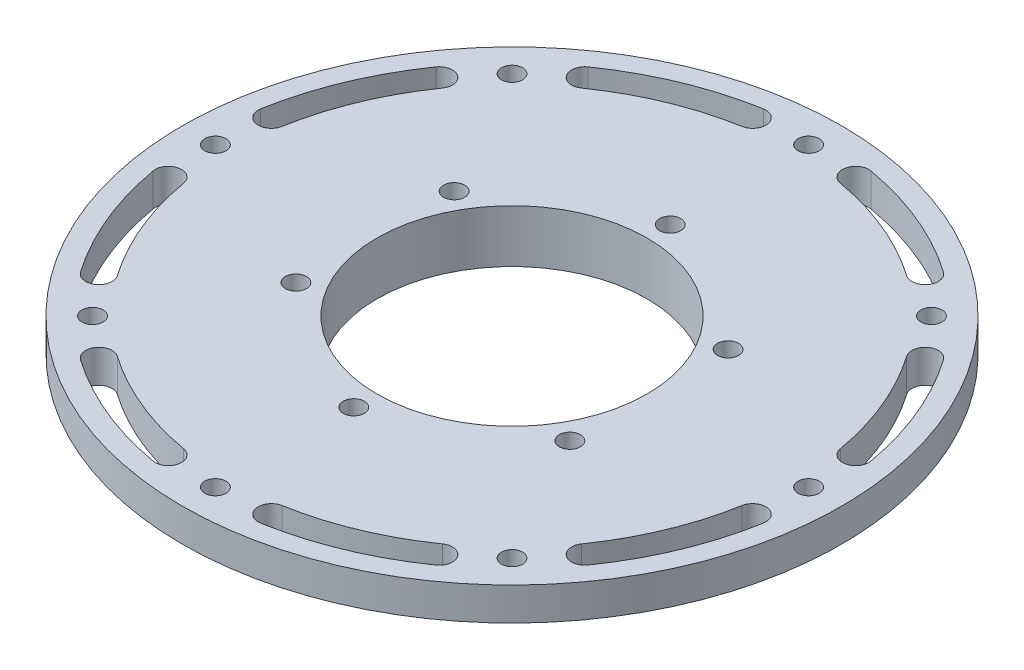
from build123d import *

# Parameters (mm, degrees)
SKETCH_1_R               = 20.5
EXTRUDE_1_DEPTH          = 7
SKETCH_2_R               = 50
EXTRUDE_2_DEPTH          = 8
CUT_EXTRUDE_1_REACH      = 74.284
SKETCH_3_R               = 16.5
CUT_EXTRUDE_2_REACH      = 73.162
SKETCH_4_R               = 1.6
PATTERN_CIRCULAR_1_COUNT = 6
SKETCH_6_R               = 50
SKETCH_6_R_2             = 27.5
CUT_EXTRUDE_3_DEPTH      = 3
CUT_EXTRUDE_4_REACH      = 74.284
SKETCH_7_R               = 1.6
PATTERN_CIRCULAR_2_COUNT = 8
CUT_EXTRUDE_5_REACH      = 73.414
PATTERN_CIRCULAR_3_COUNT = 8
SKETCH_11_R              = 20.5
EXTRUDE_3_DEPTH          = 4
SKETCH_12_R              = 2.025
CUT_EXTRUDE_6_DEPTH      = 72.561162651
SKETCH_13_R              = 5
CUT_EXTRUDE_7_DEPTH      = 73.284161474
SKETCH_14_R              = 20.5
CUT_EXTRUDE_8_DEPTH      = 73.284161474


with BuildPart() as part:
    # 草图1 → 凸台-拉伸1 (new body)
    with BuildSketch(Plane(origin=(0, 0, 0), x_dir=(1, 0, 0), z_dir=(0, 1, 0))):
        with Locations(Location((0, 0, 0), (0, 0, 270))):
            Circle(SKETCH_1_R)
    extrude(amount=EXTRUDE_1_DEPTH)

    # 草图2 → 凸台-拉伸2 (add)
    with BuildSketch(Plane(origin=(0, 7, 0), x_dir=(1, 0, 0), z_dir=(0, 1, 0))):
        with Locations(Location((0, 0, 0), (0, 0, 270))):
            Circle(SKETCH_2_R)
    extrude(amount=EXTRUDE_2_DEPTH)

    # 草图3 → 切除-拉伸1 (cut, up to next)
    with BuildSketch(Plane.XZ, mode=Mode.PRIVATE) as cut_extrude_1_sk1:
        with Locations(Location((0, 0, 0), (0, 0, 270))):
            Circle(SKETCH_3_R)
    cut_extrude_1_tool1 = extrude(cut_extrude_1_sk1.sketch, amount=-CUT_EXTRUDE_1_REACH, mode=Mode.PRIVATE) & part.part
    add(cut_extrude_1_tool1.solids().sort_by_distance((0, 0, 0))[0], mode=Mode.SUBTRACT)

    # 草图4 → 切除-拉伸2 (cut, up to next)
    with BuildSketch(Plane.XZ.offset(-7), mode=Mode.PRIVATE) as cut_extrude_2_sk1:
        with Locations(Location((0, 24, 0), (0, 0, 270))):
            Circle(SKETCH_4_R)
    cut_extrude_2_tool1 = extrude(cut_extrude_2_sk1.sketch, amount=-CUT_EXTRUDE_2_REACH, mode=Mode.PRIVATE) & part.part
    cut_extrude_2 = cut_extrude_2_tool1.solids().sort_by_distance((0, 7, 24))[0]
    add(cut_extrude_2, mode=Mode.SUBTRACT)

    # 阵列(圆周)1: 切除-拉伸2 ×6 about axis
    pattern_circular_1_axis = Axis((0, 0, 0), (0, 1, 0))
    for i in range(1, PATTERN_CIRCULAR_1_COUNT):
        add(cut_extrude_2.rotate(pattern_circular_1_axis, i * 360 / PATTERN_CIRCULAR_1_COUNT), mode=Mode.SUBTRACT)

    # 草图6 → 切除-拉伸3 (cut)
    with BuildSketch(Plane.XZ.offset(-7)):
        with Locations(Location((0, 0, 0), (0, 0, 270))):
            Circle(SKETCH_6_R)
        with Locations(Location((0, 0, 0), (0, 0, 270))):
            Circle(SKETCH_6_R_2, mode=Mode.SUBTRACT)
    extrude(amount=-CUT_EXTRUDE_3_DEPTH, mode=Mode.SUBTRACT)

    # 草图7 → 切除-拉伸4 (cut, up to next)
    with BuildSketch(Plane(origin=(0, 15, 0), x_dir=(1, 0, 0), z_dir=(0, 1, 0)), mode=Mode.PRIVATE) as cut_extrude_4_sk1:
        with Locations(Location((0, 45, 0), (0, 0, 270))):
            Circle(SKETCH_7_R)
    cut_extrude_4_tool1 = extrude(cut_extrude_4_sk1.sketch, amount=-CUT_EXTRUDE_4_REACH, mode=Mode.PRIVATE) & part.part
    cut_extrude_4 = cut_extrude_4_tool1.solids().sort_by_distance((0, 15, -45))[0]
    add(cut_extrude_4, mode=Mode.SUBTRACT)

    # 阵列(圆周)2: 切除-拉伸4 ×8 about axis
    pattern_circular_2_axis = Axis((0, 0, 0), (0, 1, 0))
    for i in range(1, PATTERN_CIRCULAR_2_COUNT):
        add(cut_extrude_4.rotate(pattern_circular_2_axis, i * 360 / PATTERN_CIRCULAR_2_COUNT), mode=Mode.SUBTRACT)

    # 草图9 → 切除-拉伸5 (cut, up to next)
    with BuildSketch(Plane.XZ.offset(-10), mode=Mode.PRIVATE) as cut_extrude_5_sk1:
        with BuildLine():
            ThreePointArc((-7.46687164, 42.34673338), (-16.455387592, 39.726819898), (-24.663786763, 35.223537904))
            ThreePointArc((-24.663786763, 35.223537904), (-27.449243724, 35.71468912), (-26.958092508, 38.500146082))
            ThreePointArc((-26.958092508, 38.500146082), (-17.986121321, 43.422338028), (-8.16146435, 46.285964392))
            ThreePointArc((-8.16146435, 46.285964392), (-5.844552489, 44.663645241), (-7.46687164, 42.34673338))
        make_face()
    cut_extrude_5_tool1 = extrude(cut_extrude_5_sk1.sketch, amount=-CUT_EXTRUDE_5_REACH, mode=Mode.PRIVATE) & part.part
    cut_extrude_5 = cut_extrude_5_tool1.solids().sort_by_distance((-17.046965, 10, 41.155015))[0]
    add(cut_extrude_5, mode=Mode.SUBTRACT)

    # 阵列(圆周)3: 切除-拉伸5 ×8 about axis
    pattern_circular_3_axis = Axis((0, 0, 0), (0, 1, 0))
    for i in range(1, PATTERN_CIRCULAR_3_COUNT):
        add(cut_extrude_5.rotate(pattern_circular_3_axis, i * 360 / PATTERN_CIRCULAR_3_COUNT), mode=Mode.SUBTRACT)

    # 草图11 → 凸台-拉伸3 (add)
    with BuildSketch(Plane.XZ):
        with Locations(Location((0, 0, 0), (0, 0, 90))):
            Circle(SKETCH_11_R)
    extrude(amount=-EXTRUDE_3_DEPTH)

    # 草图12 → 切除-拉伸6 (cut, through all)
    with BuildSketch(Plane(origin=(0, 4, 0), x_dir=(1, 0, 0), z_dir=(0, 1, 0))):
        with Locations(Location((0, 11.5, 0), (0, 0, 270))):
            Circle(SKETCH_12_R)
        with Locations(Location((11.5, 0, 0), (0, 0, 270))):
            Circle(SKETCH_12_R)
        with Locations(Location((0, -11.5, 0), (0, 0, 270))):
            Circle(SKETCH_12_R)
        with Locations(Location((-11.5, 0, 0), (0, 0, 270))):
            Circle(SKETCH_12_R)
    extrude(amount=-CUT_EXTRUDE_6_DEPTH, mode=Mode.SUBTRACT)

    # 草图13 → 切除-拉伸7 (cut, through all)
    with BuildSketch(Plane.XZ):
        with Locations(Location((0, 0, 0), (0, 0, 270))):
            Circle(SKETCH_13_R)
    extrude(amount=-CUT_EXTRUDE_7_DEPTH, mode=Mode.SUBTRACT)

    # 草图14 → 切除-拉伸8 (cut, through all)
    with BuildSketch(Plane.XZ):
        with Locations(Location((0, 0, 0), (0, 0, 270))):
            Circle(SKETCH_14_R)
    extrude(amount=-CUT_EXTRUDE_8_DEPTH, mode=Mode.SUBTRACT)


solid = part.part
